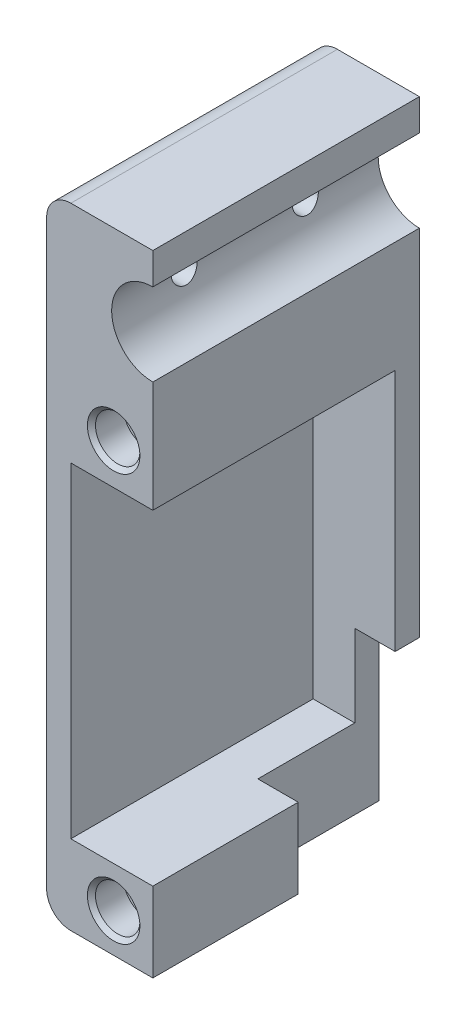
from build123d import *

# Parameters (mm, degrees)
SKETCH1_W           = 26.3
SKETCH1_H           = 60
SKETCH1_W_2         = 20.3
SKETCH1_H_2         = 40.3
BOSS_EXTRUDE1_DEPTH = 30
BOSS_EXTRUDE2_START = -30
SKETCH1_2_W         = 26.3
SKETCH1_2_H         = 60
BOSS_EXTRUDE2_DEPTH = 3
SKETCH2_W           = 26.3
SKETCH2_H           = 18
SKETCH2_R           = 5.1
BOSS_EXTRUDE3_DEPTH = 33
SKETCH3_W           = 10
SKETCH3_H           = 15
CUT_EXTRUDE1_DEPTH  = 20
CUT_EXTRUDE2_DEPTH  = 64.911579545
FILLET1_R           = 3
SKETCH5_R           = 2.75
CUT_EXTRUDE3_DEPTH  = 4
CHAMFER1_SIZE       = 0.5


with BuildPart() as part:
    # Sketch1 → Boss-Extrude1 (new body)
    with BuildSketch(Plane.XY):
        Rectangle(SKETCH1_W, SKETCH1_H)
        Rectangle(SKETCH1_W_2, SKETCH1_H_2, mode=Mode.SUBTRACT)
    extrude(amount=-BOSS_EXTRUDE1_DEPTH)

    # Sketch1<2> → Boss-Extrude2 (add)
    with BuildSketch(Plane.XY.offset(BOSS_EXTRUDE2_START)):
        Rectangle(SKETCH1_2_W, SKETCH1_2_H)
    extrude(amount=-BOSS_EXTRUDE2_DEPTH)

    # Sketch2 → Boss-Extrude3 (add)
    with BuildSketch(Plane.XY):
        with Locations((0, 39)):
            Rectangle(SKETCH2_W, SKETCH2_H)
        with Locations((0, 39)):
            Circle(SKETCH2_R, mode=Mode.SUBTRACT)
    extrude(amount=-BOSS_EXTRUDE3_DEPTH)

    # Sketch3 → Cut-Extrude1 (cut)
    with BuildSketch(Plane.XZ.offset(30)):
        with Locations((0, -25.5)):
            Rectangle(SKETCH3_W, SKETCH3_H)
    extrude(amount=-CUT_EXTRUDE1_DEPTH, mode=Mode.SUBTRACT)

    # Sketch4 → Cut-Extrude2 (cut, through all)
    with BuildSketch(Plane(origin=(13.15, 0, 0), x_dir=(0, 0, -1), z_dir=(1, 0, 0))):
        with BuildLine():
            ThreePointArc((7.4, 39), (9, 37.4), (10.6, 39))
            Line((10.6, 39), (7.4, 39))
        make_face()
        with BuildLine():
            Line((7.4, 39), (10.6, 39))
            ThreePointArc((10.6, 39), (9, 40.6), (7.4, 39))
        make_face()
        with BuildLine():
            ThreePointArc((22.4, 39), (24, 37.4), (25.6, 39))
            Line((25.6, 39), (22.4, 39))
        make_face()
        with BuildLine():
            Line((22.4, 39), (25.6, 39))
            ThreePointArc((25.6, 39), (24, 40.6), (22.4, 39))
        make_face()
    extrude(amount=-CUT_EXTRUDE2_DEPTH, mode=Mode.SUBTRACT)

    # Fillet1
    fillet1_edges = [part.edges().sort_by_distance(p)[0] for p in [
        (-13.15, 48, -16.5),
        (13.15, 48, -16.5),
        (13.15, -30, -16.5),
        (-13.15, -30, -16.5),
    ]]
    fillet(fillet1_edges, radius=FILLET1_R)

    # Sketch5 → Cut-Extrude3 (cut)
    with BuildSketch(Plane.XY):
        with Locations((5.15, 25.2)):
            Circle(SKETCH5_R)
        with Locations((-4.85, 25.2)):
            Circle(SKETCH5_R)
        with Locations((5.15, -25.2)):
            Circle(SKETCH5_R)
        with Locations((-4.85, -25.2)):
            Circle(SKETCH5_R)
    extrude(amount=-CUT_EXTRUDE3_DEPTH, mode=Mode.SUBTRACT)

    # Chamfer1
    chamfer1_edges = [part.edges().sort_by_distance(p)[0] for p in [
        (-7.6, 25.2, 0),
        (2.4, -25.2, 0),
        (-7.6, -25.2, 0),
        (2.4, 25.2, 0),
    ]]
    chamfer(chamfer1_edges, length=CHAMFER1_SIZE)

    # SurfaceCut2
    split(bisect_by=Plane.ZY, keep=Keep.TOP)


solid = part.part
